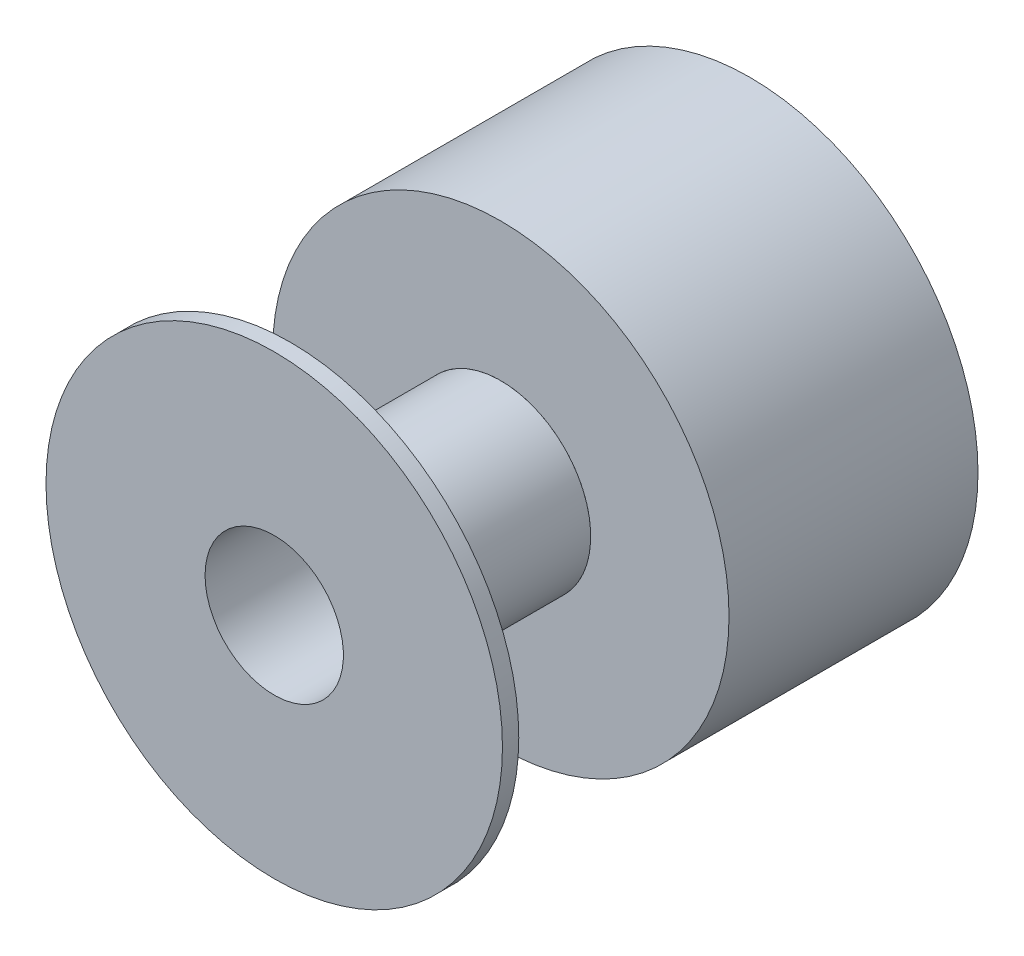
from build123d import *

# Parameters (mm, degrees)
SKETCH1_R           = 3.25
SKETCH1_R_2         = 2.5
BOSS_EXTRUDE1_DEPTH = 7.6
SKETCH1_3_R         = 8.25
SKETCH1_3_R_2       = 3.25
BOSS_EXTRUDE2_DEPTH = 9
SKETCH2_R           = 8.25
SKETCH2_R_2         = 2.5
BOSS_EXTRUDE3_DEPTH = 0.59


with BuildPart() as part:
    # Sketch1 → Boss-Extrude1 (new body)
    with BuildSketch(Plane.XY):
        with Locations(Location((0, 0, 0), (0, 0, 180))):
            Circle(SKETCH1_R)
        with Locations(Location((0, 0, 0), (0, 0, 180))):
            Circle(SKETCH1_R_2, mode=Mode.SUBTRACT)
    extrude(amount=BOSS_EXTRUDE1_DEPTH)

    # Sketch2 → Boss-Extrude3 (add)
    with BuildSketch(Plane.XY.offset(7.6)):
        Circle(SKETCH2_R)
        with Locations(Location((0, 0, 0), (0, 0, 180))):
            Circle(SKETCH2_R_2, mode=Mode.SUBTRACT)
    extrude(amount=BOSS_EXTRUDE3_DEPTH)


with BuildPart() as body_2:
    # Sketch1<3> → Boss-Extrude2 (new body)
    with BuildSketch(Plane.XY):
        Circle(SKETCH1_3_R)
        Circle(SKETCH1_3_R_2, mode=Mode.SUBTRACT)
    extrude(amount=-BOSS_EXTRUDE2_DEPTH)


solid = Compound([part.part, body_2.part])
